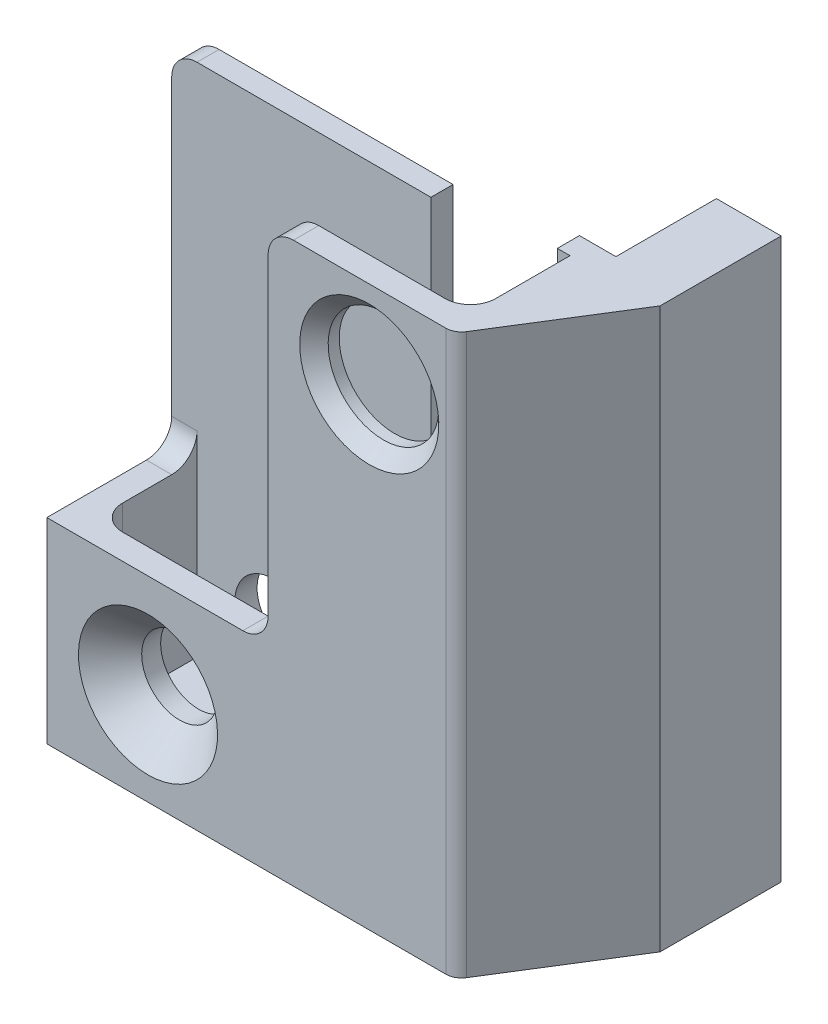
from build123d import *

# Parameters (mm, degrees)
BOSS_EXTRUDE1_DEPTH                             = 15.4
CUT_EXTRUDE2_REACH                              = 25.918
SKETCH3_W                                       = 7
SKETCH3_H                                       = 11.5
BOSS_EXTRUDE3_REACH                             = 25.918
SKETCH4_W                                       = 0.8
SKETCH4_H                                       = 6.2
SKETCH4_W_2                                     = 2.8
SKETCH4_H_2                                     = 17.7
SKETCH10_W                                      = 4
SKETCH10_H                                      = 0.7
CUT_EXTRUDE4_DEPTH                              = 16.3
BOSS_EXTRUDE4_DEPTH                             = 0.8
CSK_FOR_M2_FLAT_HEAD_MACHINE_SCREW3_D           = 2.4
CSK_FOR_M2_FLAT_HEAD_MACHINE_SCREW3_CSINK_D     = 4.4
CSK_FOR_M2_FLAT_HEAD_MACHINE_SCREW3_CSINK_ANGLE = 90
MOVE_FACE1_BY                                   = 0.6
FILLET3_R                                       = 0.8
CHAMFER1_SIZE                                   = 2.5
CHAMFER1_SIZE2                                  = 4
SKETCH12_W                                      = 2.0475
SKETCH12_H                                      = 3.18
BOSS_EXTRUDE5_DEPTH                             = 17.7
FILLET5_R                                       = 0.5
SKETCH11_R                                      = 1.75
CUT_EXTRUDE5_DEPTH                              = 25.492262043
CUT_EXTRUDE5_DIRECTION_2_REACH                  = 26.492


with BuildPart() as part:
    # Sketch2 → Boss-Extrude1 (new body)
    with BuildSketch(Plane(origin=(0, 0, 0), x_dir=(0, 0, -1), z_dir=(1, 0, 0))):
        Polygon((0, 0), (-4.65, 0), (-4.65, 17.7), (-3.85, 17.7), (-3.85, 0.8), (-0.7, 0.8), (-0.7, 17.7), (0, 17.7), align=None)
    extrude(amount=BOSS_EXTRUDE1_DEPTH)

    # Sketch3 → Cut-Extrude2 (cut, up to next)
    with BuildSketch(Plane.XY.offset(4.65), mode=Mode.PRIVATE) as cut_extrude2_sk1:
        with Locations((3.5, 11.95)):
            Rectangle(SKETCH3_W, SKETCH3_H)
    cut_extrude2_tool1 = extrude(cut_extrude2_sk1.sketch, amount=-CUT_EXTRUDE2_REACH, mode=Mode.PRIVATE) & part.part
    add(cut_extrude2_tool1.solids().sort_by_distance((3.5, 11.95, 4.65))[0], mode=Mode.SUBTRACT)

    # Sketch4 → Boss-Extrude3 (add, up to next)
    with BuildSketch(Plane.XY.offset(4.65), mode=Mode.PRIVATE) as boss_extrude3_sk1:
        with Locations((0.4, 3.1)):
            Rectangle(SKETCH4_W, SKETCH4_H)
    boss_extrude3_tool1 = extrude(boss_extrude3_sk1.sketch, amount=-BOSS_EXTRUDE3_REACH, mode=Mode.PRIVATE) - part.part
    # Sketch4 → Boss-Extrude3 (add, up to next)
    with BuildSketch(Plane.XY.offset(4.65), mode=Mode.PRIVATE) as boss_extrude3_sk2:
        with Locations((14, 8.85)):
            Rectangle(SKETCH4_W_2, SKETCH4_H_2)
    boss_extrude3_tool2 = extrude(boss_extrude3_sk2.sketch, amount=-BOSS_EXTRUDE3_REACH, mode=Mode.PRIVATE) - part.part
    add(boss_extrude3_tool1.solids().sort_by_distance((0.4, 3.1, 4.65))[0])
    add(boss_extrude3_tool2.solids().sort_by_distance((14, 8.85, 4.65))[0])

    # Sketch10 → Cut-Extrude4 (cut)
    with BuildSketch(Plane(origin=(0, 17.7, 0), x_dir=(1, 0, 0), z_dir=(0, 1, 0))):
        with Locations((10.2, -0.35)):
            Rectangle(SKETCH10_W, SKETCH10_H)
    extrude(amount=-CUT_EXTRUDE4_DEPTH, mode=Mode.SUBTRACT)

    # Sketch6 → Boss-Extrude4 (add)
    with BuildSketch(Plane(origin=(0, 0, 3.85), x_dir=(-1, 0, 0), z_dir=(0, 0, -1))):
        with BuildLine():
            Line((-0.8, 0.8), (-5.05, 0.8))
            Line((-5.05, 0.8), (-5.05, 2.95))
            ThreePointArc((-5.05, 2.95), (-4.508147545, 4.258147545), (-3.2, 4.8))
            Line((-3.2, 4.8), (-0.8, 4.8))
            Line((-0.8, 4.8), (-0.8, 0.8))
        make_face()
    extrude(amount=BOSS_EXTRUDE4_DEPTH)

    # CSK for M2 Flat Head Machine Screw3 (through all)
    with Locations(Plane(origin=(10.2, 14.95, 4.65), x_dir=(0, 1, 0), z_dir=(0, 0, 1))):
        with Locations((0, 0), (-12, 7)):
            CounterSinkHole(CSK_FOR_M2_FLAT_HEAD_MACHINE_SCREW3_D / 2, CSK_FOR_M2_FLAT_HEAD_MACHINE_SCREW3_CSINK_D / 2, counter_sink_angle=CSK_FOR_M2_FLAT_HEAD_MACHINE_SCREW3_CSINK_ANGLE)

    # Move Face1: a face moved inward by 0.6
    extrude(part.faces().sort_by_distance((4.1, 17.7, 0.35))[0], amount=MOVE_FACE1_BY, dir=(0, -1, 0), mode=Mode.SUBTRACT)

    # Fillet3
    fillet3_edges = [part.edges().sort_by_distance(p)[0] for p in [
        (0.8, 5.5, 3.85),
        (12.6, 9.25, 3.85),
        (0.4, 6.2, 0.7),
        (7, 6.2, 4.25),
        (7, 17.7, 4.25),
        (0, 17.1, 0.35),
    ]]
    fillet(fillet3_edges, radius=FILLET3_R)

    # Chamfer1
    chamfer1_edges = [part.edges().sort_by_distance(p)[0] for p in [
        (15.4, 8.85, 4.65),
    ]]
    chamfer1_side = [part.faces().sort_by_distance(p)[0] for p in [
        (9.979105197, 7.278141181, 4.65),
    ]]
    chamfer(chamfer1_edges, length=CHAMFER1_SIZE, length2=CHAMFER1_SIZE2, reference=chamfer1_side[0])

    # Sketch12 → Boss-Extrude5 (add)
    with BuildSketch(Plane(origin=(0, 17.7, 0), x_dir=(1, 0, 0), z_dir=(0, 1, 0))):
        with Locations((14.37625, 1.59)):
            Rectangle(SKETCH12_W, SKETCH12_H)
    extrude(amount=-BOSS_EXTRUDE5_DEPTH)

    # Fillet5
    fillet5_edges = [part.edges().sort_by_distance(p)[0] for p in [
        (12.9, 8.85, 4.65),
    ]]
    fillet(fillet5_edges, radius=FILLET5_R)

    # Sketch11 → Cut-Extrude5 (cut)
    with BuildSketch(Plane(origin=(0, 0, 3.85), x_dir=(-1, 0, 0), z_dir=(0, 0, -1))):
        with Locations(Location((-10.2, 14.95, 0), (0, 0, 270))):
            Circle(SKETCH11_R)
    extrude(amount=-CUT_EXTRUDE5_DEPTH, mode=Mode.SUBTRACT)

    # Sketch11 → Cut-Extrude5 direction 2 (cut, up to next)
    with BuildSketch(Plane(origin=(0, 0, 3.85), x_dir=(-1, 0, 0), z_dir=(0, 0, -1)), mode=Mode.PRIVATE) as cut_extrude5_direction_2_sk1:
        with Locations(Location((-10.2, 14.95, 0), (0, 0, 270))):
            Circle(SKETCH11_R)
    cut_extrude5_direction_2_tool1 = extrude(cut_extrude5_direction_2_sk1.sketch, amount=CUT_EXTRUDE5_DIRECTION_2_REACH, mode=Mode.PRIVATE) & part.part
    add(cut_extrude5_direction_2_tool1.solids().sort_by_distance((10.2, 14.95, 3.85))[0], mode=Mode.SUBTRACT)


solid = part.part
